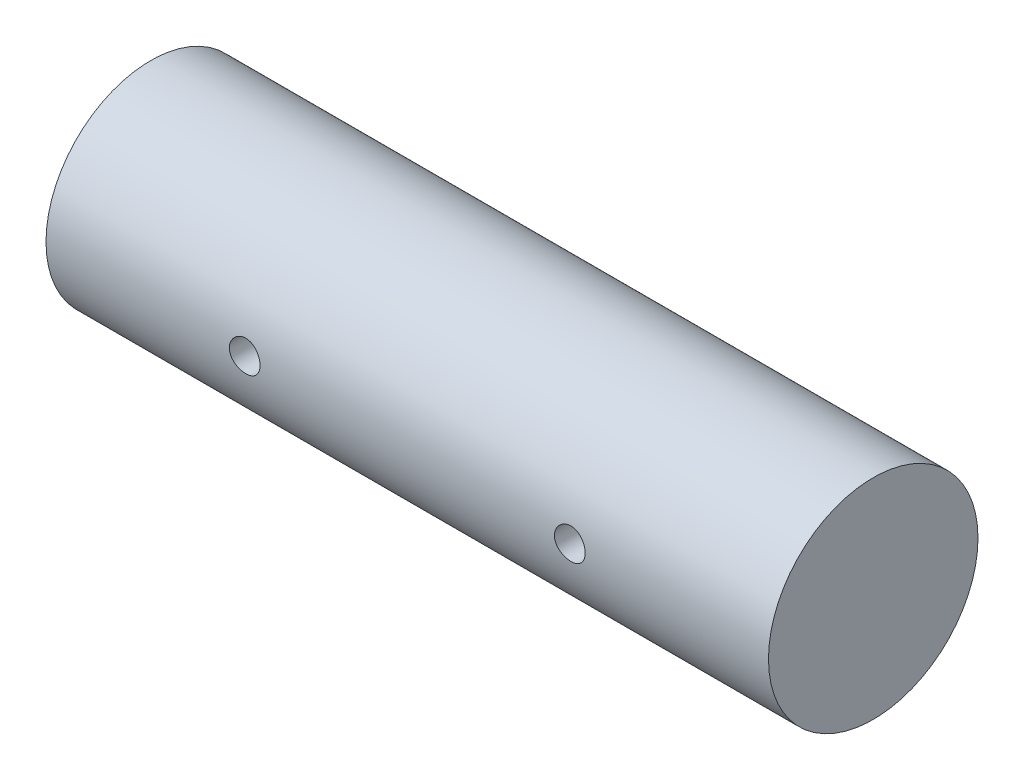
from build123d import *

# Parameters (mm, degrees)
SKETCH1_R               = 11.6
BOSS_EXTRUDE1_DEPTH     = 40
CUT_EXTRUDE1_DEPTH      = 44.233320483
CUT_EXTRUDE1_DEPTH_BACK = 44.233320483
SKETCH2_R               = 1.7


with BuildPart() as part:
    # Sketch1 → Boss-Extrude1 (new, symmetric)
    with BuildSketch(Plane(origin=(0, 0, 0), x_dir=(0, 0, -1), z_dir=(1, 0, 0))):
        Circle(SKETCH1_R)
    extrude(amount=BOSS_EXTRUDE1_DEPTH, both=True)

    # Sketch2 → Cut-Extrude1 (cut, two sides: drawn at the far end of the back side and taken through both)
    with BuildSketch(Plane.XY.offset(-CUT_EXTRUDE1_DEPTH_BACK)):
        with Locations((18, 0)):
            Circle(SKETCH2_R)
        with Locations((-18, 0)):
            Circle(SKETCH2_R)
    extrude(amount=CUT_EXTRUDE1_DEPTH + CUT_EXTRUDE1_DEPTH_BACK, mode=Mode.SUBTRACT)


solid = part.part
